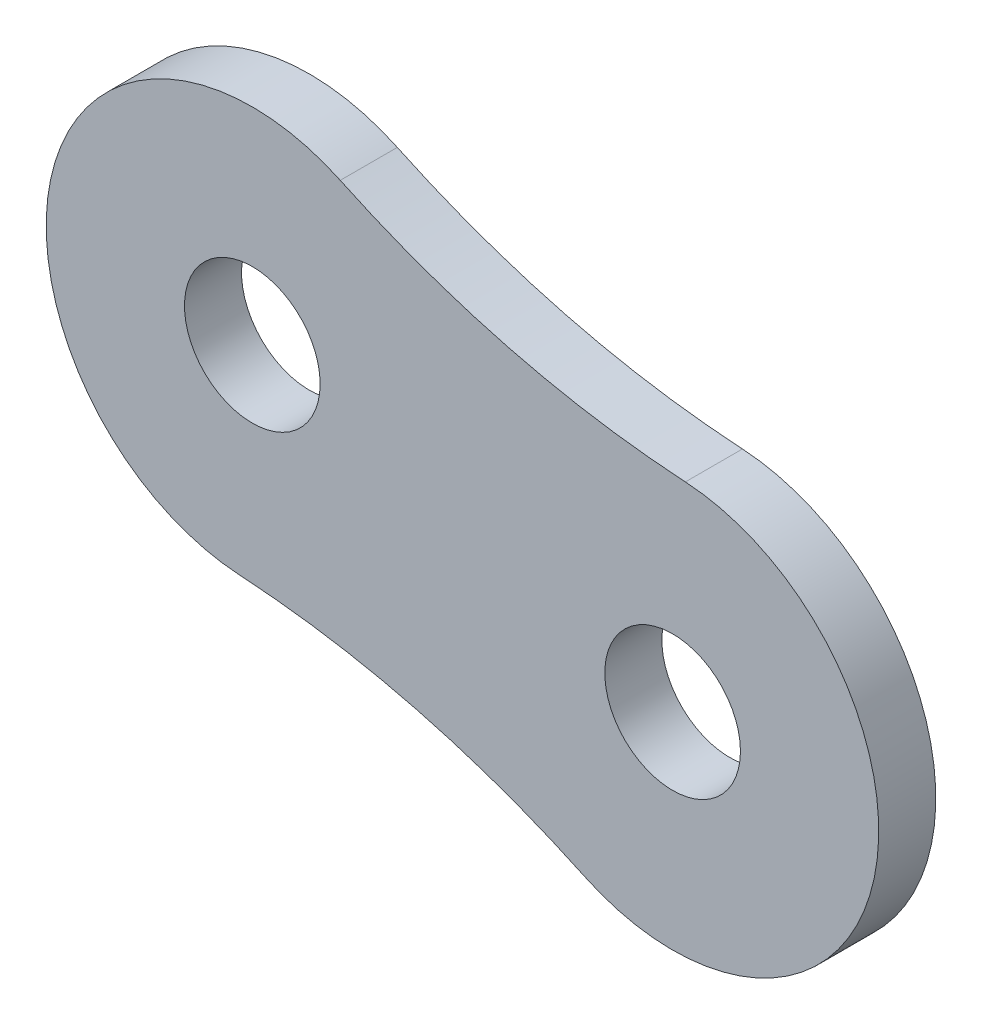
from build123d import *

# Parameters (mm, degrees)
SKETCH_2_R        = 7.94
EXTRUDE_1_DEPTH   = 7.875
EXTRUDE_1_2_DEPTH = 7.875
EXTRUDE_2_DEPTH   = 3.43
SKETCH_6_R        = 3.97
EXTRUDE_4_DEPTH   = 3.34


with BuildPart() as part:
    # 草图2 → 拉伸1 (new, symmetric)
    with BuildSketch(Plane.XY):
        with Locations((12.7, 0)):
            Circle(SKETCH_2_R)
    extrude(amount=EXTRUDE_1_DEPTH, both=True)



with BuildPart() as body_2:
    # 草图2 → Extrude 1 2 (new, symmetric)
    with BuildSketch(Plane.XY):
        with Locations((-12.7, 0)):
            Circle(SKETCH_2_R)
    extrude(amount=EXTRUDE_1_2_DEPTH, both=True)


with BuildPart() as part_1:
    add(part.part)

    add(body_2.part)  # 拉伸2 merges body 2
    # 草图3 → 拉伸2 (add)
    with BuildSketch(Plane.XY.offset(7.875)):
        with BuildLine():
            ThreePointArc((-10.428153415, 11.849174574), (-24.765, 0), (-10.428153415, -11.849174574))
            ThreePointArc((-10.428153415, -11.849174574), (0, -10.8585), (10.428153415, -11.849174574))
            ThreePointArc((10.428153415, -11.849174574), (24.765, 0), (10.428153415, 11.849174574))
            ThreePointArc((10.428153415, 11.849174574), (0, 10.8585), (-10.428153415, 11.849174574))
        make_face()
    extrude(amount=EXTRUDE_2_DEPTH)


with BuildPart() as body_2_2:
    # 草图6 → 拉伸4 (new body)
    with BuildSketch(Plane.XY.offset(11.305)):
        with BuildLine():
            ThreePointArc((32.154770058, -17.228648829), (48.987968132, -9.317166623), (38.048309834, 5.725173103))
            ThreePointArc((38.048309834, 5.725173103), (27.701405286, 7.358998688), (17.847242234, 10.911925695))
            ThreePointArc((17.847242234, 10.911925695), (1.014044161, 3.000443489), (11.953702459, -12.041896237))
            ThreePointArc((11.953702459, -12.041896237), (22.300607007, -13.675721822), (32.154770058, -17.228648829))
        make_face()
        with Locations((12.7, 0)):
            Circle(SKETCH_6_R, mode=Mode.SUBTRACT)
        with Locations((37.302012293, -6.316723134)):
            Circle(SKETCH_6_R, mode=Mode.SUBTRACT)
    extrude(amount=EXTRUDE_4_DEPTH)


solid = body_2_2.part
